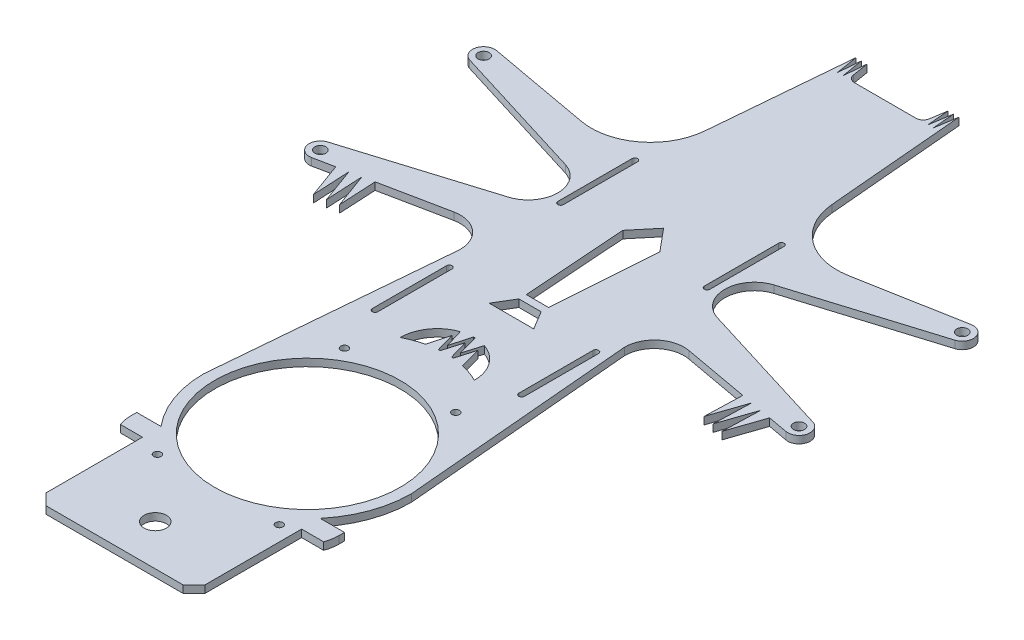
from build123d import *

# Parameters (mm, degrees)
SKETCH_1_R          = 1.5
SKETCH_1_R_2        = 25
SKETCH_1_R_3        = 1
EXTRUDE_1_DEPTH     = 2
CUT_EXTRUDE_1_DEPTH = 10
EXTRUDE_2_DEPTH     = 2
CUT_EXTRUDE_2_DEPTH = 2
CUT_EXTRUDE_3_DEPTH = 2
SKETCH_6_R          = 3
EXTRUDE_3_DEPTH     = 2


with BuildPart() as part:
    # 草图1 → 凸台-拉伸1 (new body)
    with BuildSketch(Plane(origin=(0, 0, 0), x_dir=(1, 0, 0), z_dir=(0, 1, 0))):
        with BuildLine():
            Line((-65.384333619, -19.133302588), (-28.141777015, -7.644526431))
            ThreePointArc((-28.141777015, -7.644526431), (-22.5, 0), (-28.141777015, 7.644526431))
            Line((-28.141777015, 7.644526431), (-65.384333619, 19.133302588))
            ThreePointArc((-65.384333619, 19.133302588), (-67.41435877, 22.711697239), (-63.963475544, 24.951633702))
            Line((-63.963475544, 24.951633702), (-35.956989403, 19.860837807))
            ThreePointArc((-35.956989403, 19.860837807), (-23.387681178, 22.884481961), (-17.156151846, 34.211351583))
            Line((-17.156151846, 34.211351583), (-13.884981819, 71.681117341))
            Line((-13.884981819, 71.681117341), (-12.908791343, 65.681117341))
            Line((-12.908791343, 65.681117341), (-12.384981819, 71.681117341))
            Line((-12.384981819, 71.681117341), (-11.408791343, 65.681117341))
            Line((-11.408791343, 65.681117341), (-10.884981819, 71.681117341))
            Line((-10.884981819, 71.681117341), (-10.181933712, 67.359943609))
            ThreePointArc((-10.181933712, 67.359943609), (-9.503585574, 66.157577472), (-8.20789029, 65.681117341))
            Line((-8.20789029, 65.681117341), (8.315681587, 65.681117341))
            ThreePointArc((8.315681587, 65.681117341), (9.616278401, 66.161759606), (10.291753417, 67.372669415))
            Line((10.291753417, 67.372669415), (10.964265319, 71.681117341))
            Line((10.964265319, 71.681117341), (11.488074843, 65.681117341))
            Line((11.488074843, 65.681117341), (12.424623569, 71.681117341))
            Line((12.424623569, 71.681117341), (12.948433093, 65.681117341))
            Line((12.948433093, 65.681117341), (13.884981819, 71.681117341))
            Line((13.884981819, 71.681117341), (17.156151846, 34.211351583))
            ThreePointArc((17.156151846, 34.211351583), (23.387681178, 22.884481961), (35.956989403, 19.860837807))
            Line((35.956989403, 19.860837807), (63.963475544, 24.951633702))
            ThreePointArc((63.963475544, 24.951633702), (67.41435877, 22.711697239), (65.384333619, 19.133302588))
            Line((65.384333619, 19.133302588), (28.141777015, 7.644526431))
            ThreePointArc((28.141777015, 7.644526431), (22.5, 0), (28.141777015, -7.644526431))
            Line((28.141777015, -7.644526431), (65.384333619, -19.133302588))
            ThreePointArc((65.384333619, -19.133302588), (67.41435877, -22.711697239), (63.963475544, -24.951633702))
            Line((63.963475544, -24.951633702), (58.552147091, -23.968005533))
            Line((58.552147091, -23.968005533), (55.287915388, -33.53852231))
            Line((55.287915388, -33.53852231), (55.60051339, -23.431481077))
            Line((55.60051339, -23.431481077), (52.336281687, -33.001997855))
            Line((52.336281687, -33.001997855), (52.648879688, -22.894956622))
            Line((52.648879688, -22.894956622), (49.384647985, -32.465473399))
            Line((49.384647985, -32.465473399), (49.697245987, -22.358432166))
            Line((49.697245987, -22.358432166), (31.930731882, -19.128976796))
            ThreePointArc((31.930731882, -19.128976796), (25.373883295, -20.858100658), (22.5, -27))
            Line((22.5, -27), (28, -90))
            Line((28, -90), (28, -109.5))
            ThreePointArc((28, -109.5), (24.924621202, -116.924621202), (17.5, -120))
            Line((17.5, -120), (-17.5, -120))
            ThreePointArc((-17.5, -120), (-24.924621202, -116.924621202), (-28, -109.5))
            Line((-28, -109.5), (-28, -90))
            Line((-28, -90), (-22.5, -27))
            ThreePointArc((-22.5, -27), (-25.142969185, -20.335475151), (-32.064056542, -18.464719321))
            Line((-32.064056542, -18.464719321), (-49.692991602, -22.050022904))
            Line((-49.692991602, -22.050022904), (-49.169938488, -32.148360166))
            Line((-49.169938488, -32.148360166), (-52.632809487, -22.647911521))
            Line((-52.632809487, -22.647911521), (-52.109756374, -32.746248782))
            Line((-52.109756374, -32.746248782), (-55.572627373, -23.245800138))
            Line((-55.572627373, -23.245800138), (-55.04957426, -33.344137399))
            Line((-55.04957426, -33.344137399), (-58.512445259, -23.843688755))
            Line((-58.512445259, -23.843688755), (-63.902111383, -24.939817886))
            ThreePointArc((-63.902111383, -24.939817886), (-67.406788203, -22.742012359), (-65.384333619, -19.133302588))
        make_face()
        with Locations(Location((-64.5, 22, 0), (0, 0, 270))):
            Circle(SKETCH_1_R, mode=Mode.SUBTRACT)
        with Locations(Location((64.5, 22, 0), (0, 0, 90))):
            Circle(SKETCH_1_R, mode=Mode.SUBTRACT)
        with Locations(Location((64.5, -22, 0), (0, 0, 270))):
            Circle(SKETCH_1_R, mode=Mode.SUBTRACT)
        with Locations(Location((-64.5, -22, 0), (0, 0, 90))):
            Circle(SKETCH_1_R, mode=Mode.SUBTRACT)
        with Locations(Location((0, -90, 0), (0, 0, 270))):
            Circle(SKETCH_1_R_2, mode=Mode.SUBTRACT)
        with Locations(Location((-15, -65, 0), (0, 0, 270))):
            Circle(SKETCH_1_R_3, mode=Mode.SUBTRACT)
        with Locations(Location((15, -65, 0), (0, 0, 270))):
            Circle(SKETCH_1_R_3, mode=Mode.SUBTRACT)
        with Locations(Location((-15.42, -115, 0), (0, 0, 270))):
            Circle(SKETCH_1_R_3, mode=Mode.SUBTRACT)
        with Locations(Location((17.43, -115, 0), (0, 0, 270))):
            Circle(SKETCH_1_R_3, mode=Mode.SUBTRACT)
    extrude(amount=EXTRUDE_1_DEPTH)

    # 草图2 → 切除-拉伸1 (cut)
    with BuildSketch(Plane.XZ):
        with BuildLine():
            Line((-19, 2), (-19, -18))
            ThreePointArc((-19, -18), (-19.75, -18.75), (-20.5, -18))
            Line((-20.5, -18), (-20.5, 2))
            ThreePointArc((-20.5, 2), (-19.75, 2.75), (-19, 2))
        make_face()
        with BuildLine():
            Line((20.5, 2), (20.5, -18))
            ThreePointArc((20.5, -18), (19.75, -18.75), (19, -18))
            Line((19, -18), (19, 2))
            ThreePointArc((19, 2), (19.75, 2.75), (20.5, 2))
        make_face()
        with BuildLine():
            Line((-19, 52), (-19, 32))
            ThreePointArc((-19, 32), (-19.75, 31.25), (-20.5, 32))
            Line((-20.5, 32), (-20.5, 52))
            ThreePointArc((-20.5, 52), (-19.75, 52.75), (-19, 52))
        make_face()
        with BuildLine():
            Line((20.5, 52), (20.5, 32))
            ThreePointArc((20.5, 32), (19.75, 31.25), (19, 32))
            Line((19, 32), (19, 52))
            ThreePointArc((19, 52), (19.75, 52.75), (20.5, 52))
        make_face()
        with BuildLine():
            ThreePointArc((-10, 55), (0, 45), (10, 55))
            ThreePointArc((10, 55), (0, 52.595917942), (-10, 55))
        make_face()
    extrude(amount=-CUT_EXTRUDE_1_DEPTH, mode=Mode.SUBTRACT)

    # 草图3 → 凸台-拉伸2 (add)
    with BuildSketch(Plane.XZ):
        Polygon((-1.5, 52.647113875), (0, 47.5), (1.5, 52.647113875), (1.5, 53.687015642), (2, 53.687015642), (2, 52.687015642), (3.5, 47.5), (5, 53.171632657), (5, 54.171632657), (-5, 54.171632657), (-5, 53.171632657), (-3.5, 47.5), (-2, 52.687015642), (-2, 53.687015642), (-1.5, 53.687015642), align=None)
        Polygon((-1.75, 50.5), (-0.25, 45.003125488), (-0.25, 44.003125488), (0.25, 44.003125488), (0.25, 45.003125488), (1.75, 50.5), (3.25, 45.54285984), (3.25, 43.54285984), (-3.25, 43.54285984), (-3.25, 45.54285984), align=None)
    extrude(amount=-EXTRUDE_2_DEPTH)

    # 草图4 → 切除-拉伸2 (cut)
    with BuildSketch(Plane.XZ):
        with BuildLine():
            Line((-28, 108), (-21.44761059, 108))
            ThreePointArc((-21.44761059, 108), (-26.31095871, 99.57775818), (-28, 90))
            Line((-28, 90), (-28, 108))
        make_face()
        with BuildLine():
            Line((-21.44761059, 113), (-21.44761059, 119.229664467))
            ThreePointArc((-21.44761059, 119.229664467), (-25.091953813, 116.753429347), (-27.399494937, 113))
            Line((-27.399494937, 113), (-21.44761059, 113))
        make_face()
        with BuildLine():
            Line((21.44761059, 119.229664467), (21.44761059, 113))
            Line((21.44761059, 113), (27.399494937, 113))
            ThreePointArc((27.399494937, 113), (25.091953813, 116.753429347), (21.44761059, 119.229664467))
        make_face()
        with BuildLine():
            Line((21.44761059, 108), (28, 108))
            Line((28, 108), (28, 90))
            ThreePointArc((28, 90), (26.31095871, 99.57775818), (21.44761059, 108))
        make_face()
    extrude(amount=-CUT_EXTRUDE_2_DEPTH, mode=Mode.SUBTRACT)

    # 草图5 → 切除-拉伸3 (cut)
    with BuildSketch(Plane.XZ):
        Polygon((-6, 35), (6, 35), (3, 30), (-3, 30), align=None)
        Polygon((-3, 28), (3, 28), (5, 0), (0, -6), (-5, 0), align=None)
    extrude(amount=-CUT_EXTRUDE_3_DEPTH, mode=Mode.SUBTRACT)

    # 草图6 → 凸台-拉伸3 (add)
    with BuildSketch(Plane.XZ):
        Polygon((-21.44761059, 119.229664467), (-21.44761059, 139), (-18.44761059, 142), (18.44761059, 142), (21.44761059, 139), (21.44761059, 119.229664467), align=None)
        with Locations(Location((0, 131, 0), (0, 0, 270))):
            Circle(SKETCH_6_R, mode=Mode.SUBTRACT)
    extrude(amount=-EXTRUDE_3_DEPTH)


solid = part.part
